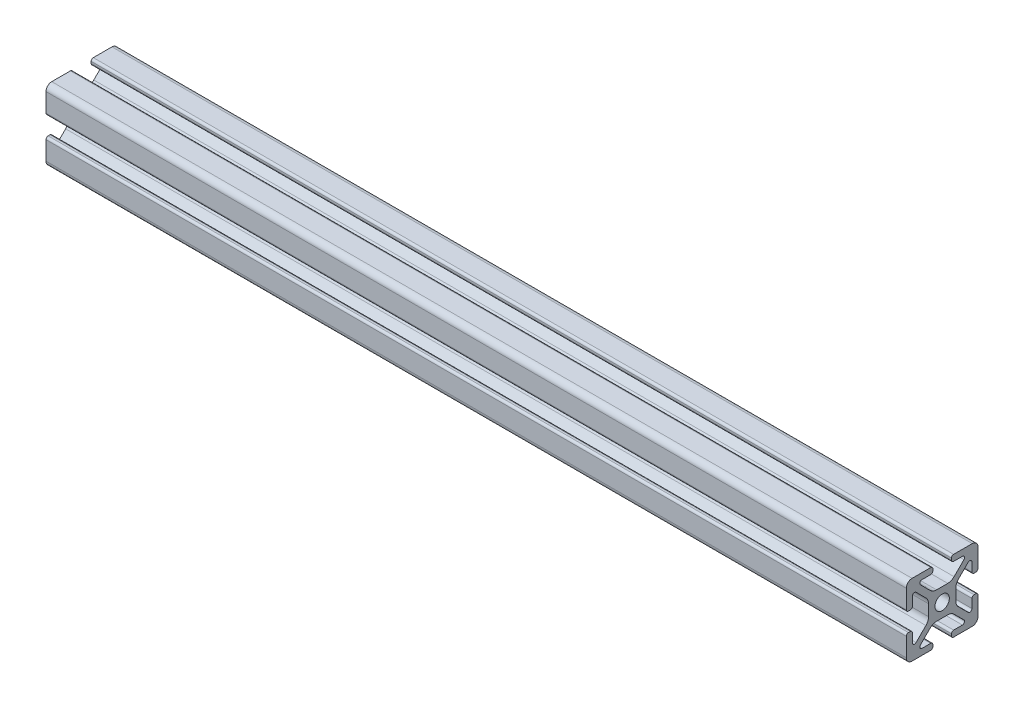
from build123d import *

# Parameters (mm, degrees)
BOSS_EXTRUDE1_DEPTH      = 152.4
BOSS_EXTRUDE1_DEPTH_BACK = 152.4


with BuildPart() as part:
    # Sketch3 → Boss-Extrude1 (new, two sides: drawn at the far end of the back side and taken through both)
    with BuildSketch(Plane(origin=(0, 0, 0), x_dir=(0, 0, -1), z_dir=(1, 0, 0)).offset(-BOSS_EXTRUDE1_DEPTH_BACK)):
        with BuildLine():
            Line((0, 4.826), (1.984228399, 4.826))
            ThreePointArc((1.984228399, 4.826), (3.199248297, 5.067682484), (4.229292429, 5.75593597))
            Line((4.229292429, 5.75593597), (7.713541092, 9.240184633))
            ThreePointArc((7.713541092, 9.240184633), (7.878721929, 10.070604775), (7.174725725, 10.541))
            Line((7.174725725, 10.541), (4.064, 10.541))
            ThreePointArc((4.064, 10.541), (3.525184633, 10.764184633), (3.302, 11.303))
            Line((3.302, 11.303), (3.302, 11.938))
            ThreePointArc((3.302, 11.938), (3.525184633, 12.476815367), (4.064, 12.7))
            Line((4.064, 12.7), (10.668, 12.7))
            ThreePointArc((10.668, 12.7), (12.104840979, 12.104840979), (12.7, 10.668))
            Line((12.7, 10.668), (12.7, 4.064))
            ThreePointArc((12.7, 4.064), (12.476815367, 3.525184633), (11.938, 3.302))
            Line((11.938, 3.302), (11.303, 3.302))
            ThreePointArc((11.303, 3.302), (10.764184633, 3.525184633), (10.541, 4.064))
            Line((10.541, 4.064), (10.541, 7.174725725))
            ThreePointArc((10.541, 7.174725725), (10.070604775, 7.878721929), (9.240184633, 7.713541092))
            Line((9.240184633, 7.713541092), (5.75593597, 4.229292429))
            ThreePointArc((5.75593597, 4.229292429), (5.067682484, 3.199248297), (4.826, 1.984228399))
            Line((4.826, 1.984228399), (4.826, 0))
            Line((4.826, 0), (2.54, 0))
            ThreePointArc((2.54, 0), (1.796051224, 1.796051224), (0, 2.54))
            Line((0, 2.54), (0, 4.826))
        make_face()
    extrude(amount=BOSS_EXTRUDE1_DEPTH + BOSS_EXTRUDE1_DEPTH_BACK)

    # Mirror1: part across plane


with BuildPart() as part_1:
    add(part.part)
    add(part.part.mirror(Plane.ZX))

    # Mirror2: part across plane


with BuildPart() as part_2:
    add(part_1.part)
    add(part_1.part.mirror(Plane.XY))


solid = part_2.part
